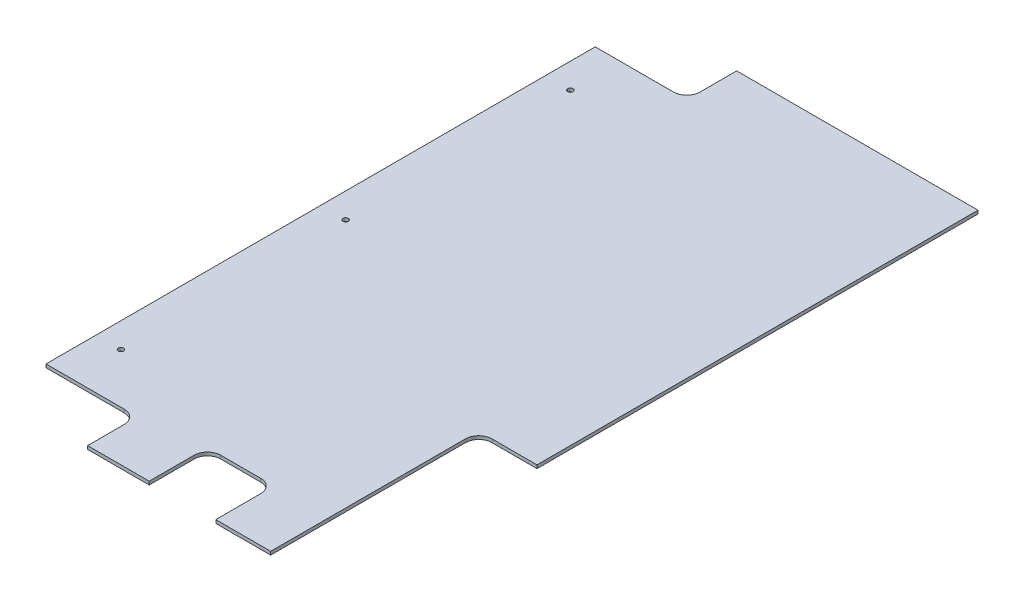
from build123d import *

# Parameters (mm, degrees)
CROQUIS1_W              = 200
CROQUIS1_H              = 390
SALIENTE_EXTRUIR1_DEPTH = 2
CROQUIS3_W              = 55
CROQUIS3_H              = 30
CORTAR_EXTRUIR1_DEPTH   = 2
CROQUIS5_W              = 40
CROQUIS5_H              = 35
CORTAR_EXTRUIR3_DEPTH   = 2
CROQUIS6_W              = 35
CROQUIS6_H              = 125
CORTAR_EXTRUIR4_DEPTH   = 2
CROQUIS7_R              = 1.6
CORTAR_EXTRUIR5_DEPTH   = 2
REDONDEO1_R             = 8


with BuildPart() as part:
    # Croquis1 → Saliente-Extruir1 (new body)
    with BuildSketch(Plane(origin=(0, 0, 0), x_dir=(1, 0, 0), z_dir=(0, 1, 0))):
        with Locations((100, 195)):
            Rectangle(CROQUIS1_W, CROQUIS1_H)
    extrude(amount=SALIENTE_EXTRUIR1_DEPTH)

    # Croquis3 → Cortar-Extruir1 (cut)
    with BuildSketch(Plane(origin=(0, 2, 0), x_dir=(1, 0, 0), z_dir=(0, 1, 0))):
        with Locations((27.5, 375)):
            Rectangle(CROQUIS3_W, CROQUIS3_H)
        with Locations((27.5, 15)):
            Rectangle(CROQUIS3_W, CROQUIS3_H)
    extrude(amount=-CORTAR_EXTRUIR1_DEPTH, mode=Mode.SUBTRACT)

    # Croquis5 → Cortar-Extruir3 (cut)
    with BuildSketch(Plane(origin=(0, 2, 0), x_dir=(1, 0, 0), z_dir=(0, 1, 0))):
        with Locations((112, 17.5)):
            Rectangle(CROQUIS5_W, CROQUIS5_H)
    extrude(amount=-CORTAR_EXTRUIR3_DEPTH, mode=Mode.SUBTRACT)

    # Croquis6 → Cortar-Extruir4 (cut)
    with BuildSketch(Plane(origin=(0, 2, 0), x_dir=(1, 0, 0), z_dir=(0, 1, 0))):
        with Locations((182.5, 62.5)):
            Rectangle(CROQUIS6_W, CROQUIS6_H)
    extrude(amount=-CORTAR_EXTRUIR4_DEPTH, mode=Mode.SUBTRACT)

    # Croquis7 → Cortar-Extruir5 (cut)
    with BuildSketch(Plane(origin=(0, 2, 0), x_dir=(1, 0, 0), z_dir=(0, 1, 0))):
        with Locations(Location((15.05, 330, 0), (0, 0, 270))):
            Circle(CROQUIS7_R)
        with Locations(Location((15.05, 195, 0), (0, 0, 270))):
            Circle(CROQUIS7_R)
        with Locations(Location((15.05, 60, 0), (0, 0, 270))):
            Circle(CROQUIS7_R)
    extrude(amount=-CORTAR_EXTRUIR5_DEPTH, mode=Mode.SUBTRACT)

    # Redondeo1
    redondeo1_edges = [part.edges().sort_by_distance(p)[0] for p in [
        (55, 1, -360),
        (55, 1, -30),
        (132, 1, -35),
        (92, 1, -35),
        (165, 1, -125),
    ]]
    fillet(redondeo1_edges, radius=REDONDEO1_R)


solid = part.part
